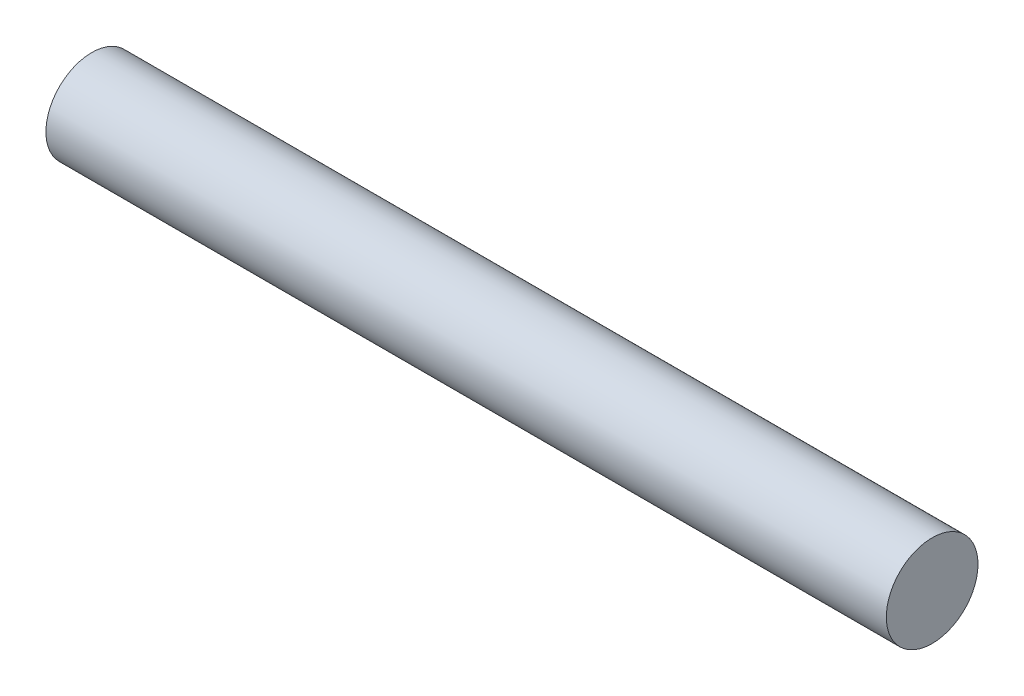
from build123d import *

# Parameters (mm, degrees)
SKETCH1_R           = 3
BOSS_EXTRUDE1_DEPTH = 55


with BuildPart() as part:
    # Sketch1 → Boss-Extrude1 (new body)
    with BuildSketch(Plane(origin=(0, 0, 0), x_dir=(0, 0, -1), z_dir=(1, 0, 0))):
        Circle(SKETCH1_R)
    extrude(amount=BOSS_EXTRUDE1_DEPTH)


solid = part.part
